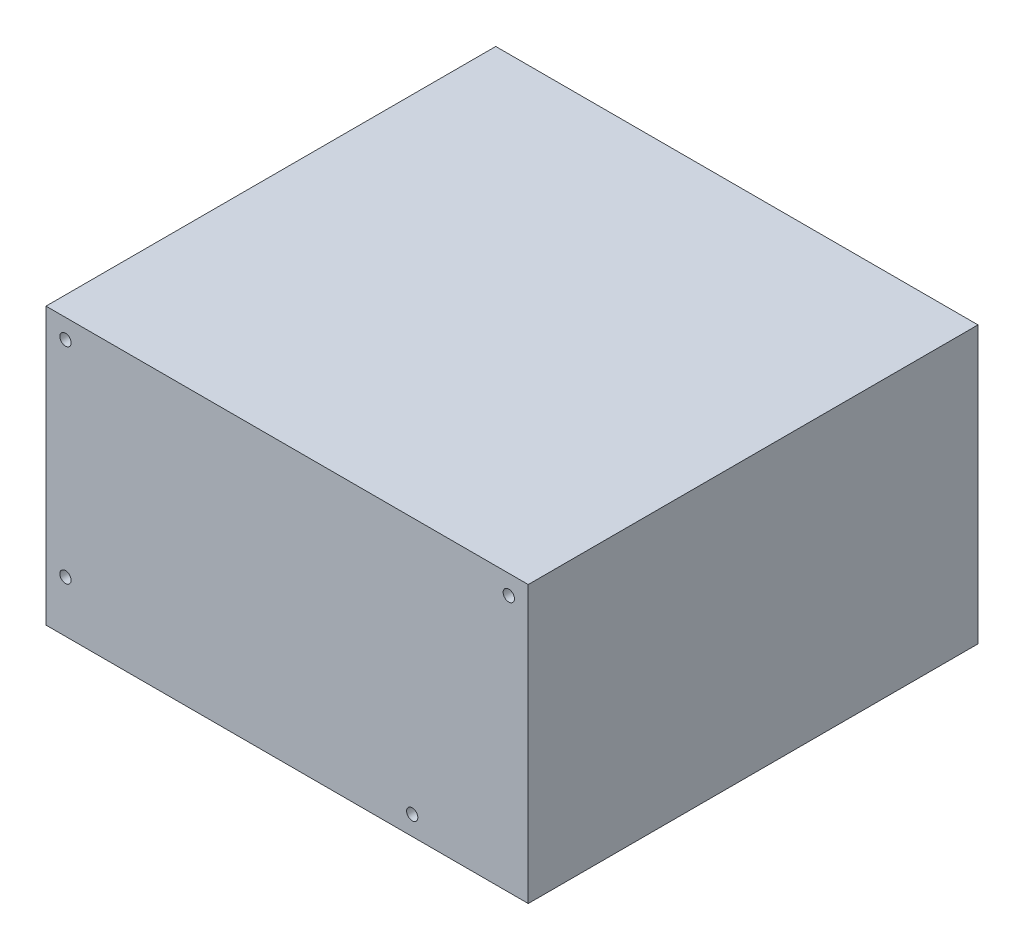
from build123d import *

# Parameters (mm, degrees)
SKETCH_1_W          = 150.114
SKETCH_1_H          = 86
EXTRUDE_1_DEPTH     = 140
SKETCH_1_3_R        = 1.7526
CUT_EXTRUDE_1_DEPTH = 127


with BuildPart() as part:
    # 스케치1 → 보스-돌출1 (new body)
    with BuildSketch(Plane.XY):
        with Locations((75.057, 43)):
            Rectangle(SKETCH_1_W, SKETCH_1_H)
    extrude(amount=-EXTRUDE_1_DEPTH)

    # 스케치1<3> → 컷-돌출1 (cut)
    with BuildSketch(Plane.XY):
        with Locations((6.0579, 80)):
            Circle(SKETCH_1_3_R)
        with Locations((144.0561, 80)):
            Circle(SKETCH_1_3_R)
        with Locations((6.0579, 16)):
            Circle(SKETCH_1_3_R)
        with Locations((114, 6)):
            Circle(SKETCH_1_3_R)
    extrude(amount=-CUT_EXTRUDE_1_DEPTH, mode=Mode.SUBTRACT)


solid = part.part
